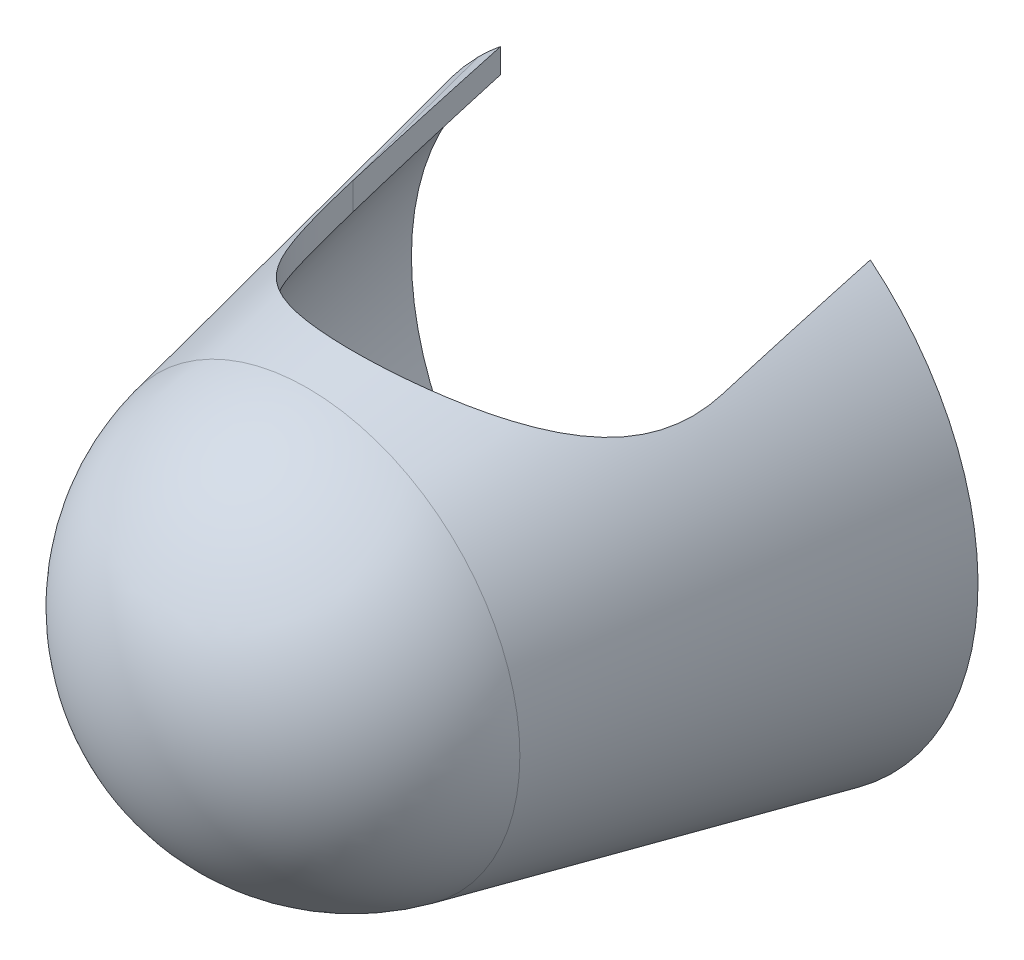
from build123d import *
from build123d.topology import SkipClean

# Parameters (mm, degrees)
SCHNITT_LINEAR_AUSTRAGEN1_DEPTH = 1561.013137418


with BuildPart() as part:
    # Skizze1 → Rotation1 (revolve)
    with BuildSketch(Plane(origin=(0, 0, 0), x_dir=(0, 0, -1), z_dir=(1, 0, 0)), mode=Mode.PRIVATE) as rotation1_sk:
        with BuildLine():
            Line((400, -791.300905503), (-622.020992923, -574.063637293))
            ThreePointArc((-622.020992923, -574.063637293), (-956.098074571, -369.340938359), (-1086.88856044, 0))
            Line((-1086.88856044, 0), (-500, 0))
            Line((-500, 0), (-500, -550))
            Line((-500, -550), (400, -741.300905503))
            Line((400, -741.300905503), (400, -791.300905503))
        make_face()
    revolve(rotation1_sk.sketch.rotate(Axis((0, 0, 0), (0, 0, -1)), 270), axis=Axis((0, 0, 0), (0, 0, -1)))

    # Skizze2 → Schnitt-Linear austragen1 (cut, through all)
    with SkipClean():  # the faces are left unmerged after this step: merging them gives an invalid solid
        with BuildSketch(Plane(origin=(0, 0, 0), x_dir=(1, 0, 0), z_dir=(0, 1, 0))):
            with BuildLine():
                Line((-500, 0), (-500, 400))
                Line((-500, 400), (500, 400))
                Line((500, 400), (500, 0))
                ThreePointArc((500, 0), (0, -500), (-500, 0))
            make_face()
        extrude(amount=SCHNITT_LINEAR_AUSTRAGEN1_DEPTH, mode=Mode.SUBTRACT)


solid = part.part
